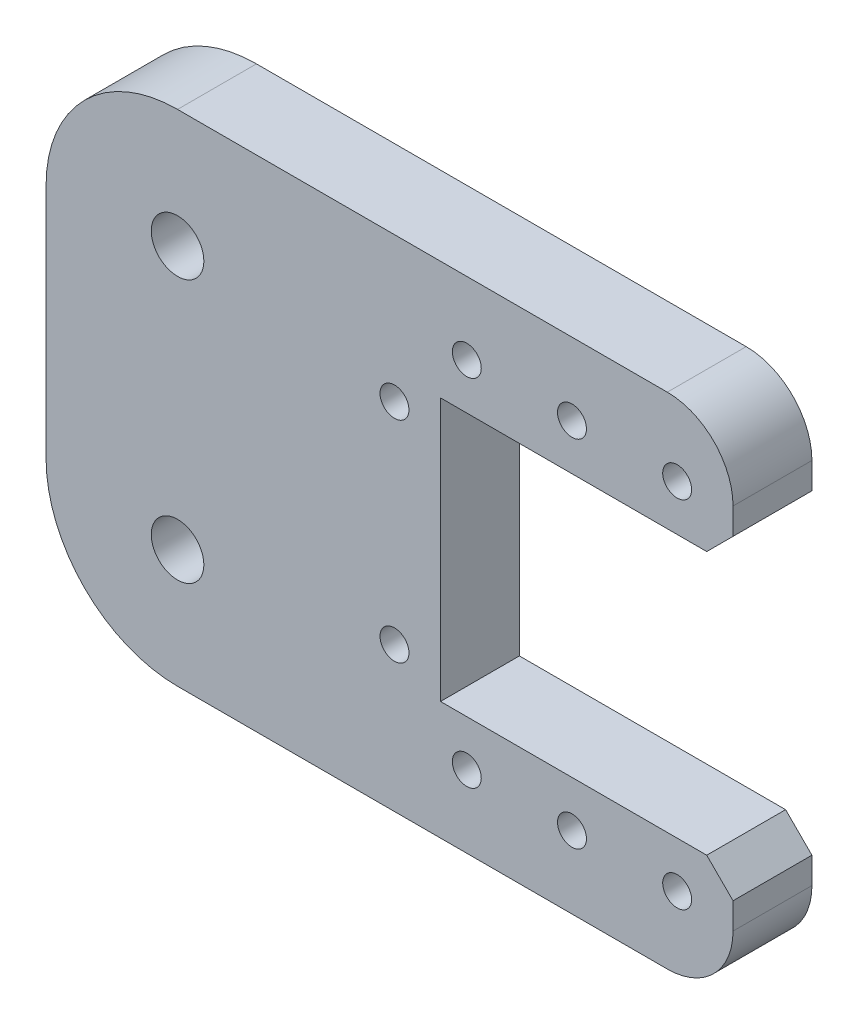
from build123d import *

# Parameters (mm, degrees)
ESQUISSE1_R             = 2
BOSS_EXTRU_1_DEPTH      = 6
CONG_1_R                = 10
CONG_2_R                = 5
CHANFREIN1_SIZE         = 2
ESQUISSE2_R             = 1.1
ENL_V_MAT_EXTRU_1_DEPTH = 6


with BuildPart() as part:
    # Esquisse1 → Boss.-Extru.1 (new body)
    with BuildSketch(Plane.XY):
        Polygon((-36.081854409, 9.183471646), (-36.081854409, -28.816528354), (16.168145591, -28.816528354), (16.168145591, -19.816528354), (-6.081854409, -19.816528354), (-6.081854409, 0.183471646), (16.168145591, 0.183471646), (16.168145591, 9.183471646), align=None)
        with Locations((-26.081854409, 0.183471646)):
            Circle(ESQUISSE1_R, mode=Mode.SUBTRACT)
        with Locations((-26.081854409, -19.816528354)):
            Circle(ESQUISSE1_R, mode=Mode.SUBTRACT)
    extrude(amount=BOSS_EXTRU_1_DEPTH)

    # Congé1
    cong_1_edges = [part.edges().sort_by_distance(p)[0] for p in [
        (-36.081854409, -28.816528354, 3),
        (-36.081854409, 9.183471646, 3),
    ]]
    fillet(cong_1_edges, radius=CONG_1_R)

    # Congé2
    cong_2_edges = [part.edges().sort_by_distance(p)[0] for p in [
        (16.168145591, 9.183471646, 3),
        (16.168145591, -28.816528354, 3),
    ]]
    fillet(cong_2_edges, radius=CONG_2_R)

    # Chanfrein1
    chanfrein1_edges = [part.edges().sort_by_distance(p)[0] for p in [
        (16.168145591, 0.183471646, 3),
        (16.168145591, -19.816528354, 3),
    ]]
    chamfer(chanfrein1_edges, length=CHANFREIN1_SIZE)

    # Esquisse2 → Enlèv. mat.-Extru.1 (cut)
    with BuildSketch(Plane.XY.offset(6)):
        with Locations((-4.081854409, 3.683471646)):
            Circle(ESQUISSE2_R)
        with Locations((3.918145591, 3.683471646)):
            Circle(ESQUISSE2_R)
        with Locations((11.918145591, 3.683471646)):
            Circle(ESQUISSE2_R)
        with Locations((-9.581854409, -1.816528354)):
            Circle(ESQUISSE2_R)
        with Locations((-9.581854409, -17.816528354)):
            Circle(ESQUISSE2_R)
        with Locations((-4.081854409, -23.316528354)):
            Circle(ESQUISSE2_R)
        with Locations((3.918145591, -23.316528354)):
            Circle(ESQUISSE2_R)
        with Locations((11.918145591, -23.316528354)):
            Circle(ESQUISSE2_R)
    extrude(amount=-ENL_V_MAT_EXTRU_1_DEPTH, mode=Mode.SUBTRACT)


solid = part.part
